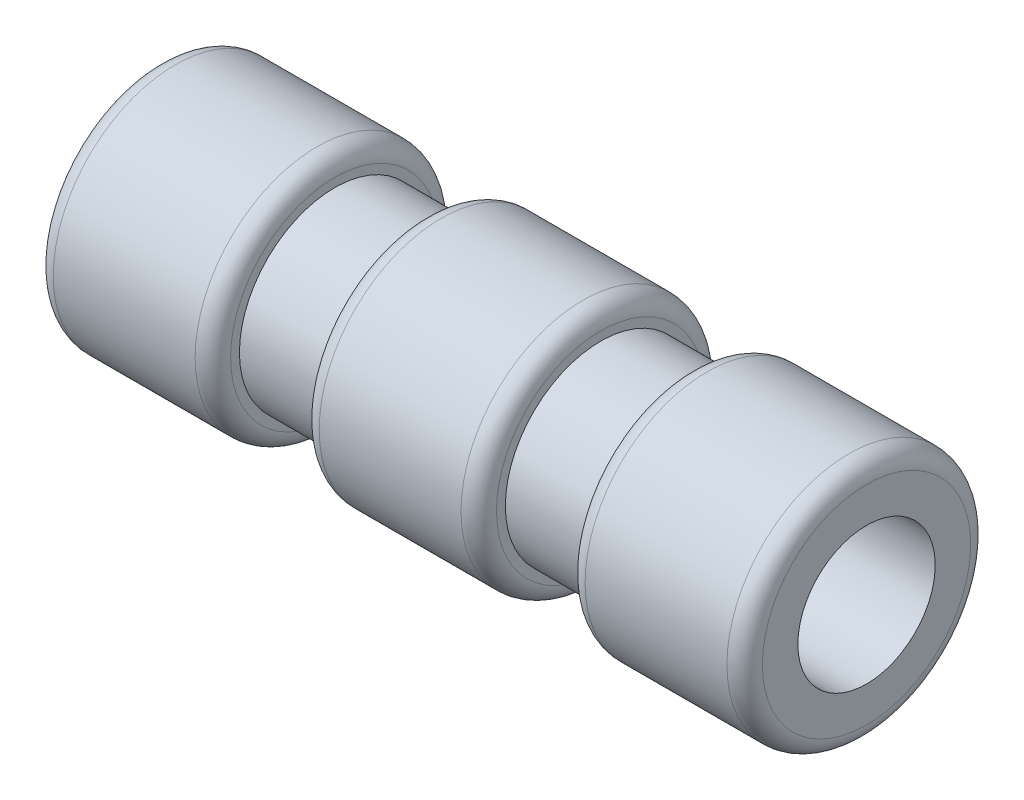
from build123d import *

# Parameters (mm, degrees)
FILLET1_R = 5


with BuildPart() as part:
    # Sketch1 → Revolve1 (revolve)
    with BuildSketch(Plane(origin=(0, 0, 0), x_dir=(1, 0, 0), z_dir=(0, 1, 0)), mode=Mode.PRIVATE) as revolve1_sk:
        Polygon((100, 19.376063405), (-100, 19.376063405), (-100, 34.376063405), (-50, 34.376063405), (-50, 26.876063405), (-25, 26.876063405), (-25, 34.376063405), (25, 34.376063405), (25, 26.876063405), (50, 26.876063405), (50, 34.376063405), (100, 34.376063405), align=None)
    revolve(revolve1_sk.sketch.rotate(Axis((-168.854447157, 0, 0), (1, 0, 0)), 180), axis=Axis((-168.854447157, 0, 0), (1, 0, 0)))

    # Fillet1
    fillet1_edges = [part.edges().sort_by_distance(p)[0] for p in [
        (-100, 0, -34.376063405),
        (-50, 0, -34.376063405),
        (-25, 0, -34.376063405),
        (25, 0, -34.376063405),
        (50, 0, -34.376063405),
        (100, 0, -34.376063405),
    ]]
    fillet(fillet1_edges, radius=FILLET1_R)


solid = part.part
